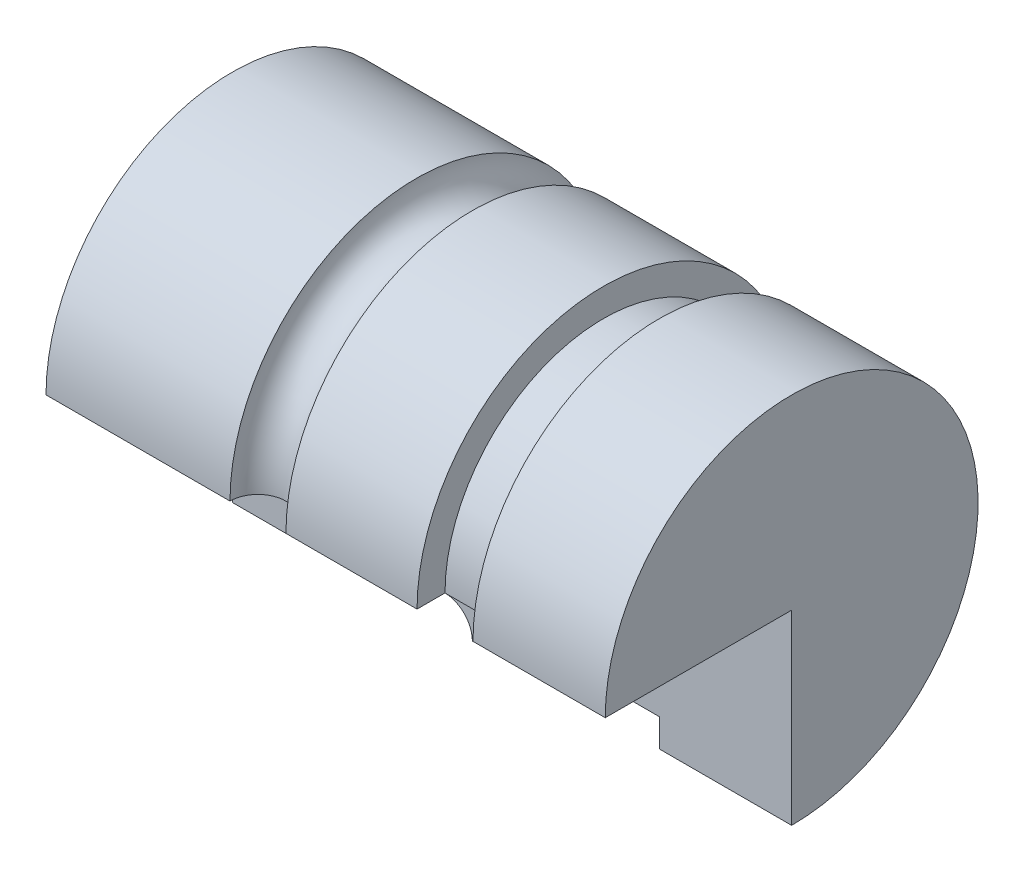
from build123d import *

# Parameters (mm, degrees)
ESQUISSE1_W             = 30
ESQUISSE1_H             = 10
ESQUISSE4_R             = 1.5
ESQUISSE4_W             = 3
ESQUISSE4_H             = 2.501285573
ESQUISSE5_W             = 24.738109029
ESQUISSE5_H             = 14.721675616
ENL_V_MAT_EXTRU_2_DEPTH = 34.166247904


with BuildPart() as part:
    # Esquisse1 → Révolution2 (revolve)
    with BuildSketch(Plane.XY, mode=Mode.PRIVATE) as r_volution2_sk:
        with Locations((15, 5)):
            Rectangle(ESQUISSE1_W, ESQUISSE1_H)
    revolve(r_volution2_sk.sketch.rotate(Axis((0, 0, 0), (1, 0, 0)), 90), axis=Axis((0, 0, 0), (1, 0, 0)))

    # Esquisse4 → Enlèvement de matière-Révolution1 (revolve, cut)
    with BuildSketch(Plane(origin=(0, 0, 0), x_dir=(1, 0, 0), z_dir=(0, 1, 0)), mode=Mode.PRIVATE) as enl_vement_de_mati_re_r_volution1_sk:
        with Locations((11.370683678, 10)):
            Circle(ESQUISSE4_R)
        with Locations((21.404481516, 9.750642787)):
            Rectangle(ESQUISSE4_W, ESQUISSE4_H)
    revolve(enl_vement_de_mati_re_r_volution1_sk.sketch.rotate(Axis((0, 0, 0), (1, 0, 0)), 180), axis=Axis((0, 0, 0), (1, 0, 0)), mode=Mode.SUBTRACT)

    # Esquisse5 → Enlèv. mat.-Extru.2 (cut, through all)
    with BuildSketch(Plane(origin=(30, 0, 0), x_dir=(0, 0, -1), z_dir=(1, 0, 0))):
        with Locations((-12.369054515, -7.360837808)):
            Rectangle(ESQUISSE5_W, ESQUISSE5_H)
    extrude(amount=-ENL_V_MAT_EXTRU_2_DEPTH, mode=Mode.SUBTRACT)


solid = part.part
